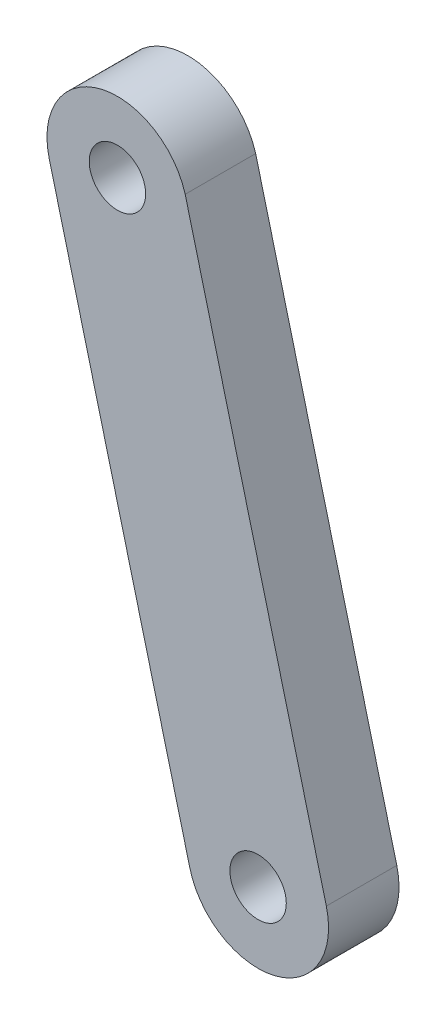
from build123d import *

# Parameters (mm, degrees)
SKETCH1_R           = 1
BOSS_EXTRUDE1_DEPTH = 2.5


with BuildPart() as part:
    # Sketch1 → Boss-Extrude1 (new body)
    with BuildSketch(Plane.XY):
        with BuildLine():
            ThreePointArc((-29.749700534, -84.597146776), (-32.811194124, -82.876948499), (-34.572983456, -85.914698236))
            Line((-34.572983456, -85.914698236), (-29.583446567, -105.211891744))
            ThreePointArc((-29.583446567, -105.211891744), (-26.537502843, -107.006300302), (-24.743094285, -103.960356578))
            Line((-24.743094285, -103.960356578), (-29.749700534, -84.597146776))
        make_face()
        with Locations((-27.163270426, -104.586124161)):
            Circle(SKETCH1_R, mode=Mode.SUBTRACT)
        with Locations((-32.152357125, -85.288814251)):
            Circle(SKETCH1_R, mode=Mode.SUBTRACT)
    extrude(amount=BOSS_EXTRUDE1_DEPTH)


solid = part.part
